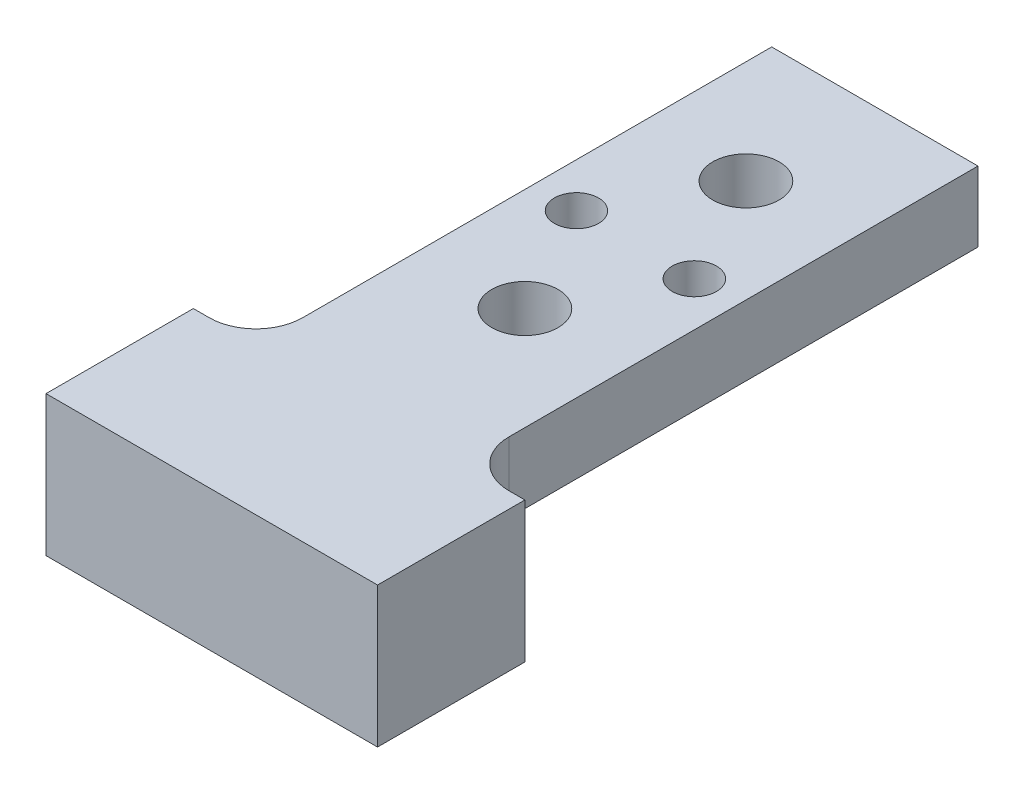
from build123d import *

# Parameters (mm, degrees)
SKETCH2_W                = 45
SKETCH2_H                = 90
EXTRUDE2_DEPTH           = 9.525
SKETCH4_W                = 70
SKETCH4_H                = 9.525
CUT_EXTRUDE1_DEPTH       = 65.348470262
SKETCH5_W                = 8.5
SKETCH5_H                = 70
CUT_EXTRUDE2_DEPTH       = 54.797328001
FILLET1_R                = 6.35
F_6_0_6_DIAMETER_HOLE1_D = 6
M8_CLEARANCE_HOLE1_D     = 9


with BuildPart() as part:
    # Sketch2 → Extrude2 (new, symmetric)
    with BuildSketch(Plane(origin=(0, 0, 0), x_dir=(1, 0, 0), z_dir=(0, 1, 0))):
        Rectangle(SKETCH2_W, SKETCH2_H)
    extrude(amount=EXTRUDE2_DEPTH, both=True)

    # Sketch4 → Cut-Extrude1 (cut, through all)
    with BuildSketch(Plane(origin=(22.5, 0, 0), x_dir=(0, 0, -1), z_dir=(1, 0, 0))):
        with Locations((10, -4.7625)):
            Rectangle(SKETCH4_W, SKETCH4_H)
    extrude(amount=-CUT_EXTRUDE1_DEPTH, mode=Mode.SUBTRACT)

    # Sketch5 → Cut-Extrude2 (cut, through all)
    with BuildSketch(Plane(origin=(0, 9.525, 0), x_dir=(1, 0, 0), z_dir=(0, 1, 0))):
        with Locations((-18.25, 10)):
            Rectangle(SKETCH5_W, SKETCH5_H)
        with Locations((18.25, 10)):
            Rectangle(SKETCH5_W, SKETCH5_H)
    extrude(amount=-CUT_EXTRUDE2_DEPTH, mode=Mode.SUBTRACT)

    # Fillet1
    fillet1_edges = [part.edges().sort_by_distance(p)[0] for p in [
        (-14, 4.7625, 25),
        (14, 4.7625, 25),
    ]]
    fillet(fillet1_edges, radius=FILLET1_R)

    # Ø6.0 (6) Diameter Hole1 (through all)
    with Locations(Plane(origin=(0, 9.525, 0), x_dir=(-1, 0, 0), z_dir=(0, 1, 0))):
        with Locations((-8, -12.5), (8, -12.5)):
            Hole(F_6_0_6_DIAMETER_HOLE1_D / 2)

    # M8 Clearance Hole1 (through all)
    with Locations(Plane(origin=(0, 9.525, 0), x_dir=(-1, 0, 0), z_dir=(0, 1, 0))):
        with Locations((0, -27.5), (0, 2.5)):
            Hole(M8_CLEARANCE_HOLE1_D / 2)


solid = part.part
